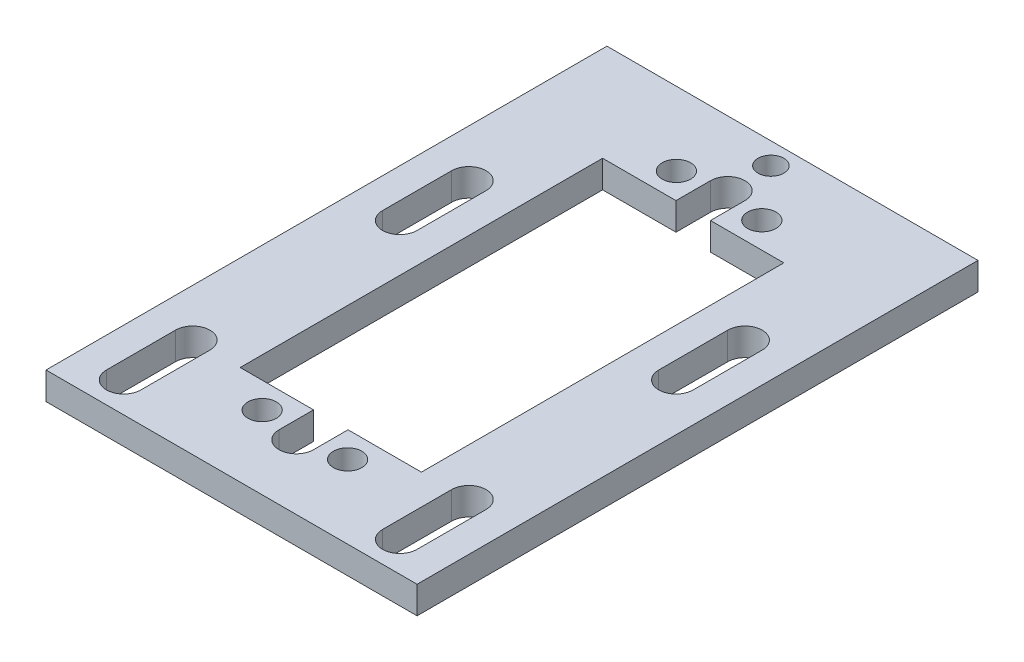
from build123d import *

# Parameters (mm, degrees)
SKETCH1_W           = 43
SKETCH1_H           = 65
SKETCH1_R           = 1.65
BOSS_EXTRUDE1_DEPTH = 3.175
CUT_EXTRUDE1_DEPTH  = 3.175
SKETCH4_R           = 1.5
CUT_EXTRUDE2_DEPTH  = 10


with BuildPart() as part:
    # Sketch1 → Boss-Extrude1 (new body)
    with BuildSketch(Plane(origin=(0, 0, 0), x_dir=(1, 0, 0), z_dir=(0, 1, 0))):
        Rectangle(SKETCH1_W, SKETCH1_H)
        with Locations(Location((-4.95, -24, 0), (0, 0, 270))):
            Circle(SKETCH1_R, mode=Mode.SUBTRACT)
        with BuildLine():
            Line((-10.5, 21), (-2, 21))
            Line((-2, 21), (-2, 24))
            Line((-2, 24), (-2, 25))
            ThreePointArc((-2, 25), (0, 27), (2, 25))
            Line((2, 25), (2, 24))
            Line((2, 24), (2, 21))
            Line((2, 21), (10.5, 21))
            Line((10.5, 21), (10.5, 0))
            Line((10.5, 0), (10.5, -21))
            Line((10.5, -21), (2, -21))
            Line((2, -21), (2, -24))
            Line((2, -24), (2, -25))
            ThreePointArc((2, -25), (0, -27), (-2, -25))
            Line((-2, -25), (-2, -24))
            Line((-2, -24), (-2, -21))
            Line((-2, -21), (-10.5, -21))
            Line((-10.5, -21), (-10.5, 0))
            Line((-10.5, 0), (-10.5, 21))
        make_face(mode=Mode.SUBTRACT)
        with BuildLine():
            ThreePointArc((6.6, -24), (4.95, -25.65), (3.3, -24))
            ThreePointArc((3.3, -24), (4.95, -22.35), (6.6, -24))
        make_face(mode=Mode.SUBTRACT)
        with Locations(Location((-4.95, 24, 0), (0, 0, 270))):
            Circle(SKETCH1_R, mode=Mode.SUBTRACT)
        with BuildLine():
            ThreePointArc((6.6, 24), (4.95, 22.35), (3.3, 24))
            ThreePointArc((3.3, 24), (4.95, 25.65), (6.6, 24))
        make_face(mode=Mode.SUBTRACT)
    extrude(amount=BOSS_EXTRUDE1_DEPTH)

    # Sketch3 → Cut-Extrude1 (cut)
    with BuildSketch(Plane(origin=(0, 3.175, 0), x_dir=(1, 0, 0), z_dir=(0, 1, 0))):
        with BuildLine():
            Line((-14, -21), (-14, -29))
            ThreePointArc((-14, -29), (-16, -31), (-18, -29))
            Line((-18, -29), (-18, -21))
            ThreePointArc((-18, -21), (-16, -19), (-14, -21))
        make_face()
        with BuildLine():
            Line((14, -21), (14, -29))
            ThreePointArc((14, -29), (16, -31), (18, -29))
            Line((18, -29), (18, -21))
            ThreePointArc((18, -21), (16, -19), (14, -21))
        make_face()
        with BuildLine():
            Line((-14, 11), (-14, 3))
            ThreePointArc((-14, 3), (-16, 1), (-18, 3))
            Line((-18, 3), (-18, 11))
            ThreePointArc((-18, 11), (-16, 13), (-14, 11))
        make_face()
        with BuildLine():
            Line((14, 11), (14, 3))
            ThreePointArc((14, 3), (16, 1), (18, 3))
            Line((18, 3), (18, 11))
            ThreePointArc((18, 11), (16, 13), (14, 11))
        make_face()
    extrude(amount=-CUT_EXTRUDE1_DEPTH, mode=Mode.SUBTRACT)

    # Sketch4 → Cut-Extrude2 (cut)
    with BuildSketch(Plane(origin=(0, 3.175, 0), x_dir=(1, 0, 0), z_dir=(0, 1, 0))):
        with Locations(Location((0, 30, 0), (0, 0, 270))):
            Circle(SKETCH4_R)
    extrude(amount=-CUT_EXTRUDE2_DEPTH, mode=Mode.SUBTRACT)


solid = part.part
